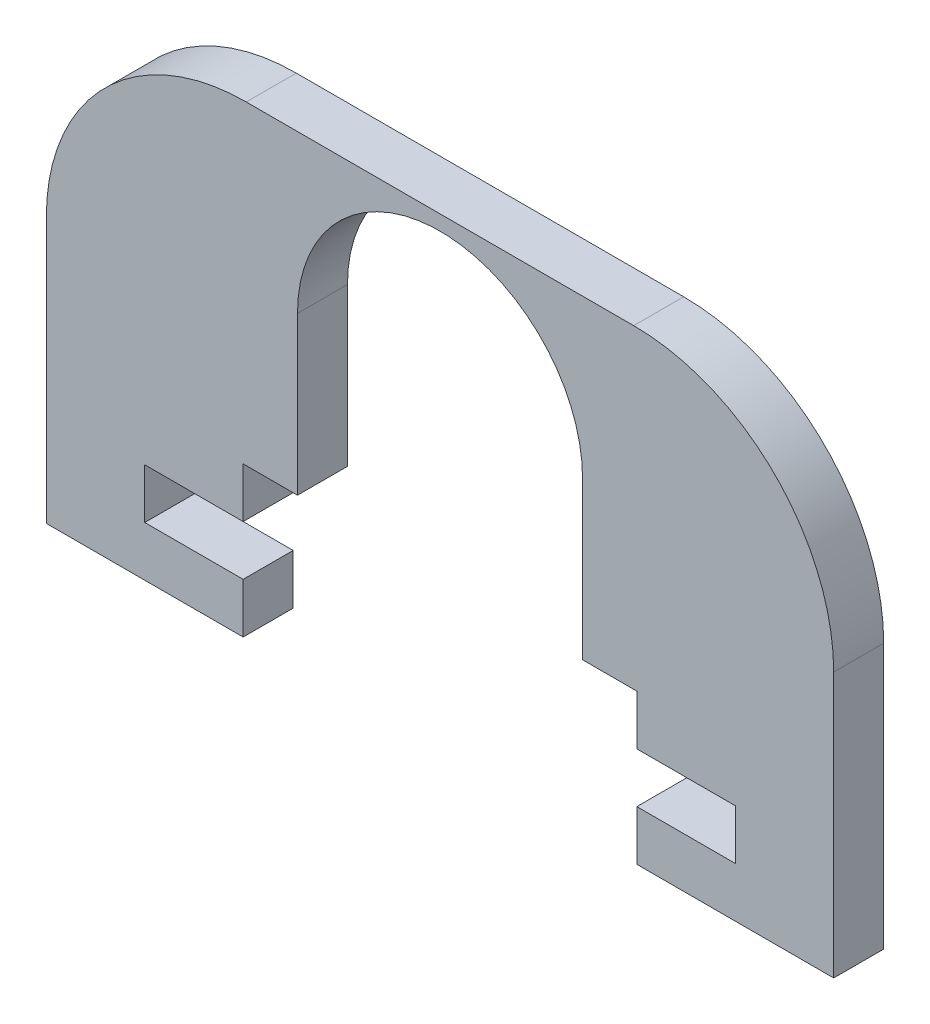
from build123d import *

# Parameters (mm, degrees)
BOSS_EXTRUDE1_DEPTH     = 6.35
CUT_EXTRUDE1_DEPTH      = 108.890326167
CUT_EXTRUDE1_DEPTH_BACK = 108.890326167
FILLET1_R               = 25.4
CUT_EXTRUDE2_DEPTH      = 108.890326167
CUT_EXTRUDE2_DEPTH_BACK = 108.890326167
SKETCH4_W               = 12.499999987
SKETCH4_H               = 6.35


with BuildPart() as part:
    # Sketch1 → Boss-Extrude1 (new body)
    with BuildSketch(Plane.XY):
        Polygon((24.999999974, 0), (74.999999923, 0), (74.999999923, -6.35), (74.999999923, -19.05), (99.999999898, -19.05), (99.999999898, -6.35), (99.999999898, 0), (99.999999898, 40.00000001), (0, 40.00000001), (0, 0), (0, -6.35), (0, -19.05), (24.999999974, -19.05), (24.999999974, -6.35), align=None)
    extrude(amount=BOSS_EXTRUDE1_DEPTH)

    # Sketch2 → Cut-Extrude1 (cut, two sides: drawn at the far end of the back side and taken through both)
    with BuildSketch(Plane.XY.offset(6.35).offset(-CUT_EXTRUDE1_DEPTH_BACK)):
        with BuildLine():
            ThreePointArc((68.099999944, 20.000000005), (49.999999949, 38.1), (31.899999954, 20.000000005))
            Line((31.899999954, 20.000000005), (31.899999954, 0))
            Line((31.899999954, 0), (68.099999944, 0))
            Line((68.099999944, 0), (68.099999944, 20.000000005))
        make_face()
    extrude(amount=CUT_EXTRUDE1_DEPTH + CUT_EXTRUDE1_DEPTH_BACK, mode=Mode.SUBTRACT)

    # Fillet1
    fillet1_edges = [part.edges().sort_by_distance(p)[0] for p in [
        (0, 40.00000001, 3.175),
        (99.999999898, 40.00000001, 3.175),
    ]]
    fillet(fillet1_edges, radius=FILLET1_R)

    # Sketch4 → Cut-Extrude2 (cut, two sides: drawn at the far end of the back side and taken through both)
    with BuildSketch(Plane.XY.offset(6.35).offset(-CUT_EXTRUDE2_DEPTH_BACK)):
        with Locations((18.749999981, -9.525)):
            Rectangle(SKETCH4_W, SKETCH4_H)
        with Locations((81.249999918, -9.525)):
            Rectangle(SKETCH4_W, SKETCH4_H)
    extrude(amount=CUT_EXTRUDE2_DEPTH + CUT_EXTRUDE2_DEPTH_BACK, mode=Mode.SUBTRACT)


solid = part.part
